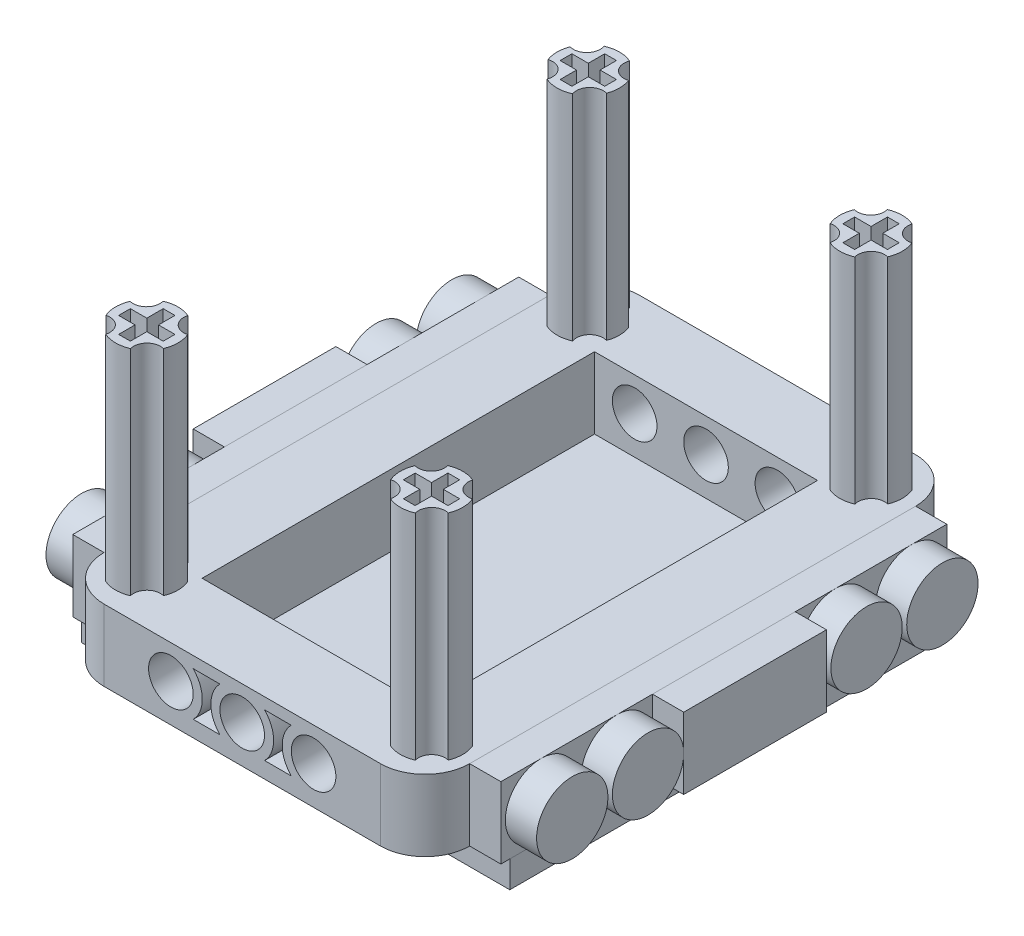
from build123d import *

# Parameters (mm, degrees)
SKETCH1_W              = 48
SKETCH1_H              = 48
BOSS_EXTRUDE1_DEPTH    = 3
SKETCH2_W              = 25
SKETCH2_H              = 44
BOSS_EXTRUDE2_DEPTH    = 8
BOSS_EXTRUDE4_DEPTH    = 24
BOSS_EXTRUDE4_2_DEPTH  = 24
BOSS_EXTRUDE4_3_DEPTH  = 24
BOSS_EXTRUDE4_4_DEPTH  = 24
SKETCH23_W             = 50
SKETCH23_H             = 8
BOSS_EXTRUDE5_DEPTH    = 3.5
SKETCH24_W             = 16
SKETCH24_H             = 8
BOSS_EXTRUDE6_DEPTH    = 3.5
SKETCH25_R             = 4
BOSS_EXTRUDE7_DEPTH    = 3.5
BOSS_EXTRUDE7_2_DEPTH  = 3.5
BOSS_EXTRUDE7_3_DEPTH  = 3.5
BOSS_EXTRUDE7_4_DEPTH  = 3.5
SKETCH5_R              = 2.5
CUT_EXTRUDE1_DEPTH     = 75.707763987
LPATTERN1_COUNT        = 3
LPATTERN1_PITCH        = 8
CUT_EXTRUDE2_DEPTH     = 2
LPATTERN2_COUNT        = 2
LPATTERN2_PITCH        = 8
LPATTERN3_COPY_1_DEPTH = 2


with BuildPart() as part:
    # Sketch1 → Boss-Extrude1 (new body)
    with BuildSketch(Plane(origin=(0, 0, 0), x_dir=(1, 0, 0), z_dir=(0, 1, 0))):
        Rectangle(SKETCH1_W, SKETCH1_H)
    extrude(amount=BOSS_EXTRUDE1_DEPTH)


with BuildPart() as body_2:
    # Sketch2 → Boss-Extrude2 (new body)
    with BuildSketch(Plane(origin=(0, 3, 0), x_dir=(1, 0, 0), z_dir=(0, 1, 0))):
        with BuildLine():
            Line((15.5, 30), (-15.5, 30))
            ThreePointArc((-15.5, 30), (-19.035533906, 28.535533906), (-20.5, 25))
            Line((-20.5, 25), (-20.5, -25))
            ThreePointArc((-20.5, -25), (-19.035533906, -28.535533906), (-15.5, -30))
            Line((-15.5, -30), (15.5, -30))
            ThreePointArc((15.5, -30), (19.035533906, -28.535533906), (20.5, -25))
            Line((20.5, -25), (20.5, 25))
            ThreePointArc((20.5, 25), (19.035533906, 28.535533906), (15.5, 30))
        make_face()
        Rectangle(SKETCH2_W, SKETCH2_H, mode=Mode.SUBTRACT)
    extrude(amount=BOSS_EXTRUDE2_DEPTH)

    # Sketch5 → Cut-Extrude1 (cut, symmetric)
    with BuildSketch(Plane.XY.offset(30)):
        with Locations(Location((-8, 7.24864976, 0), (0, 0, 180))):
            Circle(SKETCH5_R)
    cut_extrude1 = extrude(amount=CUT_EXTRUDE1_DEPTH, both=True, mode=Mode.SUBTRACT)

    # LPattern1: Cut-Extrude1 ×3
    with Locations(*[(i * LPATTERN1_PITCH, 0, 0) for i in range(1, LPATTERN1_COUNT)]):
        add(cut_extrude1, mode=Mode.SUBTRACT)

    # Sketch11 → Cut-Extrude2 (cut)
    with BuildSketch(Plane(origin=(0, 0, -30), x_dir=(-1, 0, 0), z_dir=(0, 0, -1))):
        with BuildLine():
            Line((5.502892551, 9.727788396), (2.502892551, 9.727788396))
            ThreePointArc((2.502892551, 9.727788396), (3.517142052, 7.264960246), (2.492842265, 4.80629506))
            Line((2.492842265, 4.80629506), (5.492842265, 4.80629506))
            ThreePointArc((5.492842265, 4.80629506), (4.478592765, 7.26912321), (5.502892551, 9.727788396))
        make_face()
    cut_extrude2 = extrude(amount=-CUT_EXTRUDE2_DEPTH, mode=Mode.SUBTRACT)

    # LPattern2: Cut-Extrude2 ×2
    with Locations(*[(i * LPATTERN2_PITCH, 0, 0) for i in range(1, LPATTERN2_COUNT)]):
        add(cut_extrude2, mode=Mode.SUBTRACT)

    # Mirror12: Cut-Extrude2 across plane
    add(cut_extrude2.mirror(Plane.XY), mode=Mode.SUBTRACT)

    # LPattern3 copy 1 sketch → LPattern3 copy 1 (cut)
    with BuildSketch(Plane(origin=(8, 0, 30), x_dir=(-1, 0, 0), z_dir=(0, 0, 1))):
        with BuildLine():
            Line((5.502892551, -9.727788396), (2.502892551, -9.727788396))
            ThreePointArc((2.502892551, -9.727788396), (3.517142052, -7.264960246), (2.492842265, -4.80629506))
            Line((2.492842265, -4.80629506), (5.492842265, -4.80629506))
            ThreePointArc((5.492842265, -4.80629506), (4.478592765, -7.26912321), (5.502892551, -9.727788396))
        make_face()
    extrude(amount=-LPATTERN3_COPY_1_DEPTH, mode=Mode.SUBTRACT)


with BuildPart() as body_3:
    # Sketch4 → Boss-Extrude4 (new body)
    with BuildSketch(Plane(origin=(0, 11, 0), x_dir=(1, 0, 0), z_dir=(0, 1, 0))):
        with BuildLine():
            ThreePointArc((12.273856454, 26.357202202), (12, 25), (12.273856454, 23.642797798))
            ThreePointArc((12.273856454, 23.642797798), (13.729041229, 23.248727611), (14.106820727, 21.789228829))
            ThreePointArc((14.106820727, 21.789228829), (15.5, 21.5), (16.893179273, 21.789228829))
            ThreePointArc((16.893179273, 21.789228829), (17.270958771, 23.248727611), (18.726143546, 23.642797798))
            ThreePointArc((18.726143546, 23.642797798), (19, 25), (18.726143546, 26.357202202))
            ThreePointArc((18.726143546, 26.357202202), (17.270958771, 26.751272389), (16.893179273, 28.210771171))
            ThreePointArc((16.893179273, 28.210771171), (15.5, 28.5), (14.106820727, 28.210771171))
            ThreePointArc((14.106820727, 28.210771171), (13.729041229, 26.751272389), (12.273856454, 26.357202202))
        make_face()
        Polygon((14.841235777, 25.658764223), (13, 25.658764223), (13, 24.341235777), (14.841235777, 24.341235777), (14.841235777, 22.5), (16.158764223, 22.5), (16.158764223, 24.341235777), (18, 24.341235777), (18, 25.658764223), (16.158764223, 25.658764223), (16.158764223, 27.5), (14.841235777, 27.5), align=None, mode=Mode.SUBTRACT)
    extrude(amount=BOSS_EXTRUDE4_DEPTH)


with BuildPart() as body_4:
    # Sketch4 → Boss-Extrude4 2 (new body)
    with BuildSketch(Plane(origin=(0, 11, 0), x_dir=(1, 0, 0), z_dir=(0, 1, 0))):
        with BuildLine():
            ThreePointArc((12.498957883, -23.142797798), (12.22510143, -24.5), (12.498957883, -25.857202202))
            ThreePointArc((12.498957883, -25.857202202), (13.954142659, -26.251272389), (14.331922157, -27.710771171))
            ThreePointArc((14.331922157, -27.710771171), (15.72510143, -28), (17.118280702, -27.710771171))
            ThreePointArc((17.118280702, -27.710771171), (17.4960602, -26.251272389), (18.951244976, -25.857202202))
            ThreePointArc((18.951244976, -25.857202202), (19.22510143, -24.5), (18.951244976, -23.142797798))
            ThreePointArc((18.951244976, -23.142797798), (17.4960602, -22.748727611), (17.118280702, -21.289228829))
            ThreePointArc((17.118280702, -21.289228829), (15.72510143, -21), (14.331922157, -21.289228829))
            ThreePointArc((14.331922157, -21.289228829), (13.954142659, -22.748727611), (12.498957883, -23.142797798))
        make_face()
        Polygon((15.066337206, -23.841235777), (13.22510143, -23.841235777), (13.22510143, -25.158764223), (15.066337206, -25.158764223), (15.066337206, -27), (16.383865653, -27), (16.383865653, -25.158764223), (18.22510143, -25.158764223), (18.22510143, -23.841235777), (16.383865653, -23.841235777), (16.383865653, -22), (15.066337206, -22), align=None, mode=Mode.SUBTRACT)
    extrude(amount=BOSS_EXTRUDE4_2_DEPTH)


with BuildPart() as body_5:
    # Sketch4 → Boss-Extrude4 3 (new body)
    with BuildSketch(Plane(origin=(0, 11, 0), x_dir=(1, 0, 0), z_dir=(0, 1, 0))):
        with BuildLine():
            ThreePointArc((-19.426143546, -23.142797798), (-19.7, -24.5), (-19.426143546, -25.857202202))
            ThreePointArc((-19.426143546, -25.857202202), (-17.970958771, -26.251272389), (-17.593179273, -27.710771171))
            ThreePointArc((-17.593179273, -27.710771171), (-16.2, -28), (-14.806820727, -27.710771171))
            ThreePointArc((-14.806820727, -27.710771171), (-14.429041229, -26.251272389), (-12.973856454, -25.857202202))
            ThreePointArc((-12.973856454, -25.857202202), (-12.7, -24.5), (-12.973856454, -23.142797798))
            ThreePointArc((-12.973856454, -23.142797798), (-14.429041229, -22.748727611), (-14.806820727, -21.289228829))
            ThreePointArc((-14.806820727, -21.289228829), (-16.2, -21), (-17.593179273, -21.289228829))
            ThreePointArc((-17.593179273, -21.289228829), (-17.970958771, -22.748727611), (-19.426143546, -23.142797798))
        make_face()
        Polygon((-16.858764223, -23.841235777), (-18.7, -23.841235777), (-18.7, -25.158764223), (-16.858764223, -25.158764223), (-16.858764223, -27), (-15.541235777, -27), (-15.541235777, -25.158764223), (-13.7, -25.158764223), (-13.7, -23.841235777), (-15.541235777, -23.841235777), (-15.541235777, -22), (-16.858764223, -22), align=None, mode=Mode.SUBTRACT)
    extrude(amount=BOSS_EXTRUDE4_3_DEPTH)


with BuildPart() as body_6:
    # Sketch4 → Boss-Extrude4 4 (new body)
    with BuildSketch(Plane(origin=(0, 11, 0), x_dir=(1, 0, 0), z_dir=(0, 1, 0))):
        with BuildLine():
            ThreePointArc((-19.474766276, 26.235275611), (-19.7, 25), (-19.474766276, 23.764724389))
            ThreePointArc((-19.474766276, 23.764724389), (-17.945138148, 23.357812711), (-17.631871586, 21.806296232))
            ThreePointArc((-17.631871586, 21.806296232), (-16.2, 21.5), (-14.768128414, 21.806296232))
            ThreePointArc((-14.768128414, 21.806296232), (-14.454861852, 23.357812711), (-12.925233724, 23.764724389))
            ThreePointArc((-12.925233724, 23.764724389), (-12.7, 25), (-12.925233724, 26.235275611))
            ThreePointArc((-12.925233724, 26.235275611), (-14.454861852, 26.642187289), (-14.768128414, 28.193703768))
            ThreePointArc((-14.768128414, 28.193703768), (-16.2, 28.5), (-17.631871586, 28.193703768))
            ThreePointArc((-17.631871586, 28.193703768), (-17.945138148, 26.642187289), (-19.474766276, 26.235275611))
        make_face()
        Polygon((-16.858764223, 25.658764223), (-18.7, 25.658764223), (-18.7, 24.341235777), (-16.858764223, 24.341235777), (-16.858764223, 22.5), (-15.541235777, 22.5), (-15.541235777, 24.341235777), (-13.7, 24.341235777), (-13.7, 25.658764223), (-15.541235777, 25.658764223), (-15.541235777, 27.5), (-16.858764223, 27.5), align=None, mode=Mode.SUBTRACT)
    extrude(amount=BOSS_EXTRUDE4_4_DEPTH)


with BuildPart() as body_7:
    # Sketch23 → Boss-Extrude5 (new body)
    with BuildSketch(Plane.ZY.offset(20.5)):
        with Locations((0, 7)):
            Rectangle(SKETCH23_W, SKETCH23_H)
    extrude(amount=BOSS_EXTRUDE5_DEPTH)


with BuildPart() as body_8:
    # Sketch24 → Boss-Extrude6 (new body)
    with BuildSketch(Plane.ZY.offset(24)):
        with Locations((0, 7)):
            Rectangle(SKETCH24_W, SKETCH24_H)
    extrude(amount=BOSS_EXTRUDE6_DEPTH)


with BuildPart() as body_9:
    # Sketch25 → Boss-Extrude7 (new body)
    with BuildSketch(Plane.ZY.offset(24)):
        with Locations((20.5, 7)):
            Circle(SKETCH25_R)
    extrude(amount=BOSS_EXTRUDE7_DEPTH)


with BuildPart() as body_10:
    # Sketch25 → Boss-Extrude7 2 (new body)
    with BuildSketch(Plane.ZY.offset(24)):
        with Locations((12, 7)):
            Circle(SKETCH25_R)
    extrude(amount=BOSS_EXTRUDE7_2_DEPTH)


with BuildPart() as body_11:
    # Sketch25 → Boss-Extrude7 3 (new body)
    with BuildSketch(Plane.ZY.offset(24)):
        with Locations((-12.5, 7)):
            Circle(SKETCH25_R)
    extrude(amount=BOSS_EXTRUDE7_3_DEPTH)


with BuildPart() as body_12:
    # Sketch25 → Boss-Extrude7 4 (new body)
    with BuildSketch(Plane.ZY.offset(24)):
        with Locations((-21, 7)):
            Circle(SKETCH25_R)
    extrude(amount=BOSS_EXTRUDE7_4_DEPTH)


with BuildPart() as body_13:
    # Mirror10: mirrored copy
    add(body_7.part.mirror(Plane(origin=(0, 0, 0), x_dir=(0, 0, 1), z_dir=(1, 0, 0))))


with BuildPart() as body_14:
    # Mirror10 2: mirrored copy
    add(body_8.part.mirror(Plane(origin=(0, 0, 0), x_dir=(0, 0, 1), z_dir=(1, 0, 0))))


with BuildPart() as body_15:
    # Mirror11: mirrored copy
    add(body_10.part.mirror(Plane(origin=(0, 0, 0), x_dir=(0, 0, 1), z_dir=(1, 0, 0))))


with BuildPart() as body_16:
    # Mirror11 2: mirrored copy
    add(body_9.part.mirror(Plane(origin=(0, 0, 0), x_dir=(0, 0, 1), z_dir=(1, 0, 0))))


with BuildPart() as body_17:
    # Mirror11 3: mirrored copy
    add(body_11.part.mirror(Plane(origin=(0, 0, 0), x_dir=(0, 0, 1), z_dir=(1, 0, 0))))


with BuildPart() as body_18:
    # Mirror11 4: mirrored copy
    add(body_12.part.mirror(Plane(origin=(0, 0, 0), x_dir=(0, 0, 1), z_dir=(1, 0, 0))))


solid = Compound([part.part, body_2.part, body_3.part, body_4.part, body_5.part, body_6.part, body_7.part, body_8.part, body_9.part, body_10.part, body_11.part, body_12.part, body_13.part, body_14.part, body_15.part, body_16.part, body_17.part, body_18.part])
